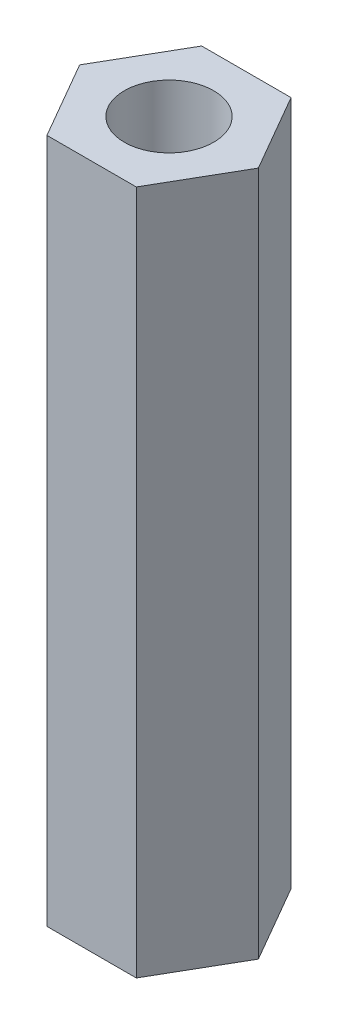
from build123d import *

# Parameters (mm, degrees)
BOSS_EXTRU_1_DEPTH = 23
SKETCH1_R          = 1.5
CUT_EXTRUDE1_DEPTH = 24.339880034


with BuildPart() as part:
    # Esquisse1 → Boss.-Extru.1 (new body)
    with BuildSketch(Plane(origin=(0, 0, 0), x_dir=(1, 0, 0), z_dir=(0, 1, 0))):
        Polygon((3, 0), (1.5, 2.598076211), (-1.5, 2.598076211), (-3, 0), (-1.5, -2.598076211), (1.5, -2.598076211), align=None)
    extrude(amount=BOSS_EXTRU_1_DEPTH)

    # Sketch1 → Cut-Extrude1 (cut, through all)
    with BuildSketch(Plane(origin=(0, 23, 0), x_dir=(1, 0, 0), z_dir=(0, 1, 0))):
        with Locations(Location((0, 0, 0), (0, 0, 270))):
            Circle(SKETCH1_R)
    extrude(amount=-CUT_EXTRUDE1_DEPTH, mode=Mode.SUBTRACT)


solid = part.part
